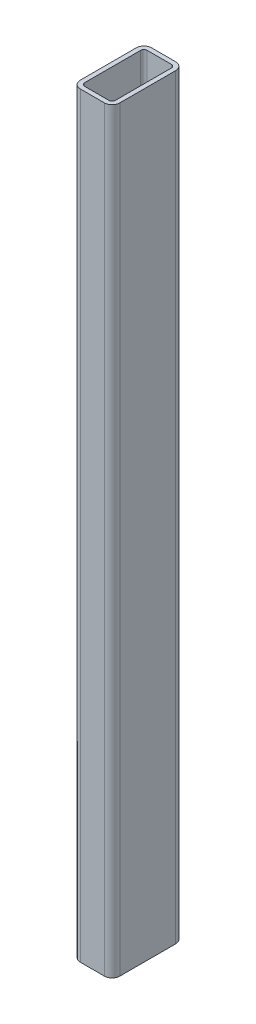
from build123d import *

# Parameters (mm, degrees)
EXTRUDE_1_DEPTH = 345


with BuildPart() as part:
    # Эскиз1 → Вытянуть-Тонкостенный1 (new body)
    with BuildSketch(Plane(origin=(0, 0, 0), x_dir=(1, 0, 0), z_dir=(0, 1, 0))):
        with BuildLine():
            Line((5.5, -16.25), (-5.5, -16.25))
            ThreePointArc((-5.5, -16.25), (-7.974873734, -15.224873734), (-9, -12.75))
            Line((-9, -12.75), (-9, 12.75))
            ThreePointArc((-9, 12.75), (-7.974873734, 15.224873734), (-5.5, 16.25))
            Line((-5.5, 16.25), (5.5, 16.25))
            ThreePointArc((5.5, 16.25), (7.974873734, 15.224873734), (9, 12.75))
            Line((9, 12.75), (9, -12.75))
            ThreePointArc((9, -12.75), (7.974873734, -15.224873734), (5.5, -16.25))
        make_face()
        with BuildLine():
            Line((5.5, -14.25), (-5.5, -14.25))
            ThreePointArc((-5.5, -14.25), (-6.560660172, -13.810660172), (-7, -12.75))
            Line((-7, -12.75), (-7, 12.75))
            ThreePointArc((-7, 12.75), (-6.560660172, 13.810660172), (-5.5, 14.25))
            Line((-5.5, 14.25), (5.5, 14.25))
            ThreePointArc((5.5, 14.25), (6.560660172, 13.810660172), (7, 12.75))
            Line((7, 12.75), (7, -12.75))
            ThreePointArc((7, -12.75), (6.560660172, -13.810660172), (5.5, -14.25))
        make_face(mode=Mode.SUBTRACT)
    extrude(amount=EXTRUDE_1_DEPTH)


solid = part.part
